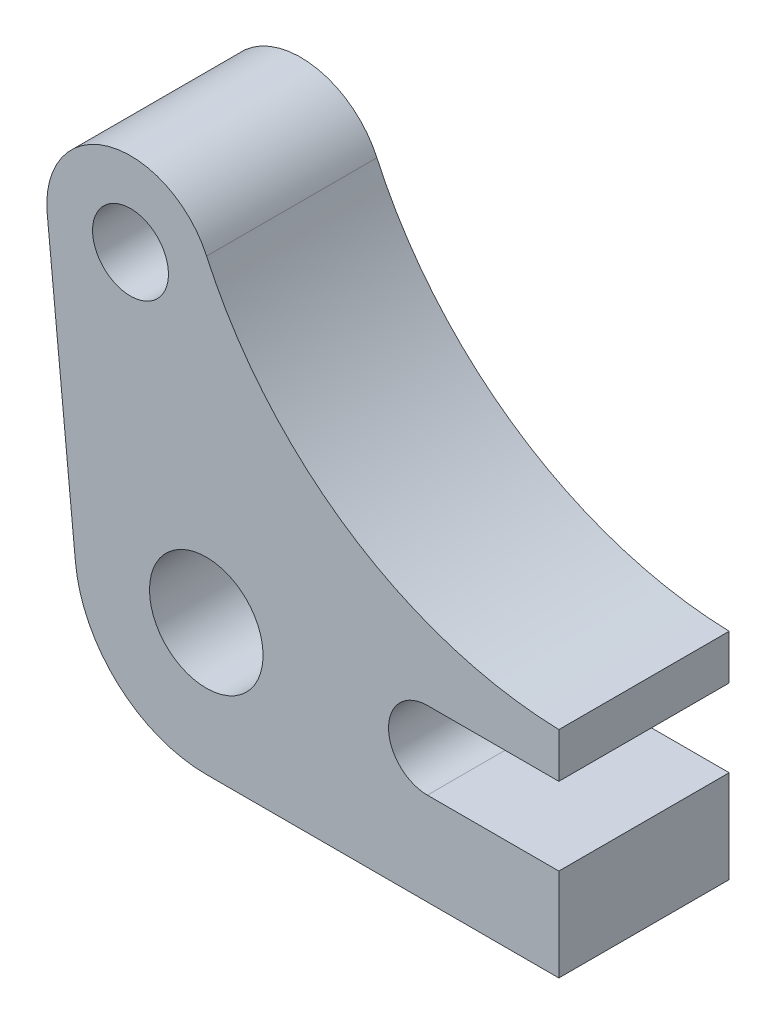
from build123d import *

# Parameters (mm, degrees)
ESQUISSE1_R        = 9.5
ESQUISSE1_R_2      = 6.35
BOSS_EXTRU_3_DEPTH = 28.5


with BuildPart() as part:
    # Esquisse1 → Boss.-Extru.3 (new body)
    with BuildSketch(Plane.XY):
        with BuildLine():
            Line((-32.183370977, -41.533470352), (26.816629023, -41.533470352))
            Line((26.816629023, -41.533470352), (26.816629023, -26.033470352))
            Line((26.816629023, -26.033470352), (4.816629023, -26.033470352))
            ThreePointArc((4.816629023, -26.033470352), (-1.683370977, -19.533470352), (4.816629023, -13.033470352))
            Line((4.816629023, -13.033470352), (26.816629023, -13.033470352))
            Line((26.816629023, -13.033470352), (26.816629023, -5.533470352))
            ThreePointArc((26.816629023, -5.533470352), (-8.245750613, 5.622429434), (-32.129953671, 33.611166634))
            ThreePointArc((-32.129953671, 33.611166634), (-48.50573191, 41.315354446), (-58.798603767, 26.429877911))
            Line((-58.798603767, 26.429877911), (-54.078241746, -21.681640278))
            ThreePointArc((-54.078241746, -21.681640278), (-46.960722933, -35.831625744), (-32.183370977, -41.533470352))
        make_face()
        with Locations(Location((-32.183370977, -19.533470352, 0), (0, 0, 180))):
            Circle(ESQUISSE1_R, mode=Mode.SUBTRACT)
        with Locations(Location((-44.865504187, 27.796895136, 0), (0, 0, 180))):
            Circle(ESQUISSE1_R_2, mode=Mode.SUBTRACT)
    extrude(amount=BOSS_EXTRU_3_DEPTH)


solid = part.part
